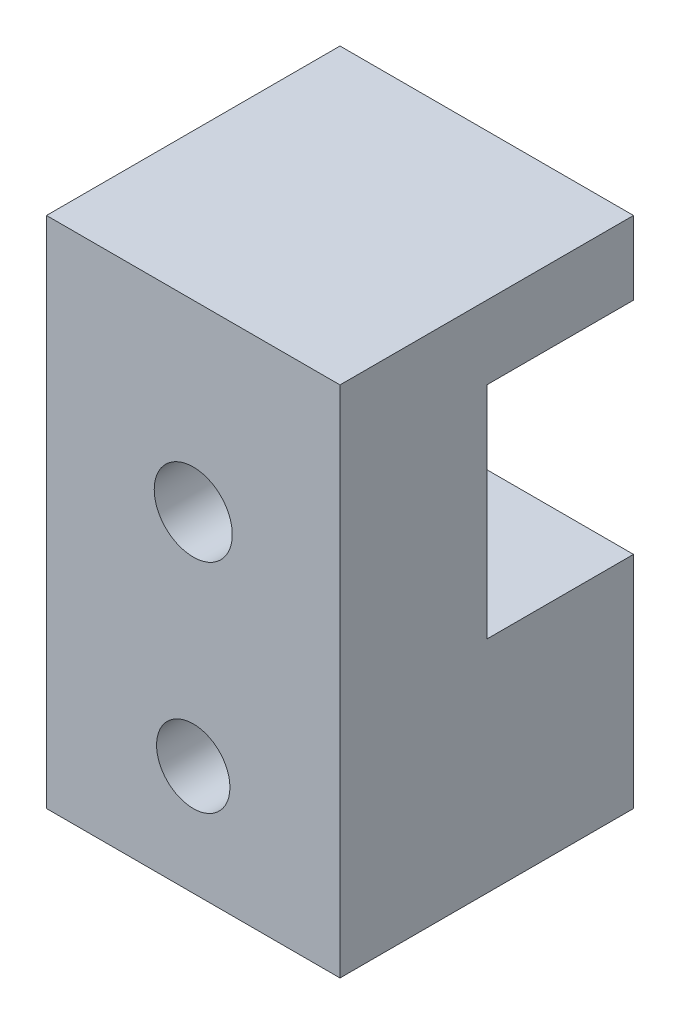
from build123d import *

# Parameters (mm, degrees)
SKETCH1_W                  = 25.4
SKETCH1_H                  = 44.45
BOSS_EXTRUDE1_DEPTH        = 12.7
SKETCH2_W                  = 25.4
SKETCH2_H                  = 19.05
CUT_EXTRUDE1_DEPTH         = 12.7
SKETCH3_R                  = 3.175
CUT_EXTRUDE2_DEPTH         = 37.061067996
F_1_4_CLEARANCE_HOLE1_D    = 6.7564
F_6_32_TAPPED_HOLE1_REACH  = 49.941
F_6_32_TAPPED_HOLE1_BORE_R = 1.35255


with BuildPart() as part:
    # Sketch1 → Boss-Extrude1 (new, symmetric)
    with BuildSketch(Plane.XY):
        Rectangle(SKETCH1_W, SKETCH1_H)
    extrude(amount=BOSS_EXTRUDE1_DEPTH, both=True)

    # Sketch2 → Cut-Extrude1 (cut)
    with BuildSketch(Plane(origin=(0, 0, -12.7), x_dir=(-1, 0, 0), z_dir=(0, 0, -1))):
        with Locations((0, 6.35)):
            Rectangle(SKETCH2_W, SKETCH2_H)
    extrude(amount=-CUT_EXTRUDE1_DEPTH, mode=Mode.SUBTRACT)

    # Sketch3 → Cut-Extrude2 (cut, through all)
    with BuildSketch(Plane.XY.offset(12.7)):
        with Locations((0, -12.7)):
            Circle(SKETCH3_R)
    extrude(amount=-CUT_EXTRUDE2_DEPTH, mode=Mode.SUBTRACT)

    # 1/4 Clearance Hole1 (through all)
    with Locations(Plane(origin=(0, 0, 0), x_dir=(-1, 0, 0), z_dir=(0, 0, -1))):
        with Locations((0, 6.35)):
            Hole(F_1_4_CLEARANCE_HOLE1_D / 2)

    # #6-32 Tapped Hole1 bore → #6-32 Tapped Hole1 (cut, up to next)
    with BuildSketch(Plane(origin=(0, -22.225, 0), x_dir=(-1, 0, 0), z_dir=(0, -1, 0)), mode=Mode.PRIVATE) as f_6_32_tapped_hole1_sk1:
        Circle(F_6_32_TAPPED_HOLE1_BORE_R)
    f_6_32_tapped_hole1_tool1 = extrude(f_6_32_tapped_hole1_sk1.sketch, amount=-F_6_32_TAPPED_HOLE1_REACH, mode=Mode.PRIVATE) & part.part
    add(f_6_32_tapped_hole1_tool1.solids().sort_by_distance((0, -22.225, 0))[0], mode=Mode.SUBTRACT)


solid = part.part
